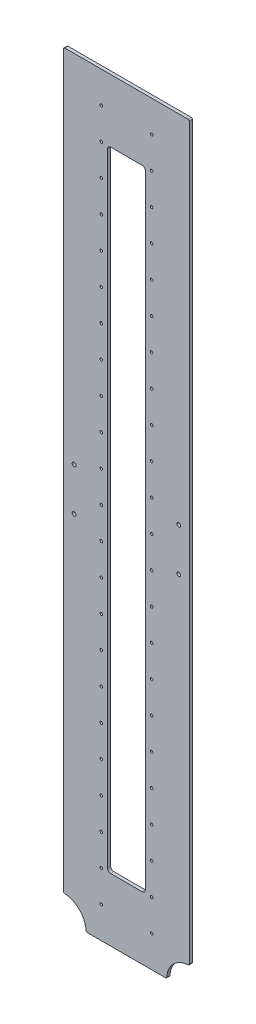
from build123d import *

# Parameters (mm, degrees)
SKETCH1_W           = 200
SKETCH1_H           = 1200
BOSS_EXTRUDE1_DEPTH = 5
CUT_EXTRUDE1_DEPTH  = 609.296802556
SKETCH5_W           = 60
SKETCH5_H           = 1000
CUT_EXTRUDE3_DEPTH  = 609.296802556
FILLET2_R           = 5
SKETCH6_R           = 3
CUT_EXTRUDE4_DEPTH  = 609.296802556
FILLET3_R           = 2
SKETCH9_R           = 2.1
CUT_EXTRUDE5_DEPTH  = 609.296802556


with BuildPart() as part:
    # Sketch1 → Boss-Extrude1 (new body)
    with BuildSketch(Plane.XY):
        Rectangle(SKETCH1_W, SKETCH1_H)
    extrude(amount=BOSS_EXTRUDE1_DEPTH)

    # Sketch3 → Cut-Extrude1 (cut, through all)
    with BuildSketch(Plane.XY.offset(5)):
        with BuildLine():
            Line((-100, -600), (-100, -564.197190267))
            ThreePointArc((-100, -564.197190267), (-74.683590452, -574.683590452), (-64.197190267, -600))
            Line((-64.197190267, -600), (-100, -600))
        make_face()
        with BuildLine():
            Line((64.197190267, -600), (100, -600))
            Line((100, -600), (100, -564.197190267))
            ThreePointArc((100, -564.197190267), (74.683590452, -574.683590452), (64.197190267, -600))
        make_face()
    extrude(amount=-CUT_EXTRUDE1_DEPTH, mode=Mode.SUBTRACT)

    # Sketch5 → Cut-Extrude3 (cut, through all)
    with BuildSketch(Plane.XY.offset(5)):
        Rectangle(SKETCH5_W, SKETCH5_H)
    extrude(amount=-CUT_EXTRUDE3_DEPTH, mode=Mode.SUBTRACT)

    # Fillet2
    fillet2_edges = [part.edges().sort_by_distance(p)[0] for p in [
        (30, 500, 2.5),
        (30, -500, 2.5),
        (-30, -500, 2.5),
        (-30, 500, 2.5),
    ]]
    fillet(fillet2_edges, radius=FILLET2_R)

    # Sketch6 → Cut-Extrude4 (cut, through all)
    with BuildSketch(Plane.XY.offset(5)):
        with Locations((83.193225438, -34)):
            Circle(SKETCH6_R)
        with Locations((83.193225438, 34)):
            Circle(SKETCH6_R)
        with Locations(Location((-83.193225438, 34, 0), (0, 0, 180))):
            Circle(SKETCH6_R)
        with Locations(Location((-83.193225438, -34, 0), (0, 0, 180))):
            Circle(SKETCH6_R)
    extrude(amount=-CUT_EXTRUDE4_DEPTH, mode=Mode.SUBTRACT)

    # Fillet3
    fillet3_edges = [part.edges().sort_by_distance(p)[0] for p in [
        (64.197190267, -600, 2.5),
        (100, -564.197190267, 2.5),
        (-64.197190267, -600, 2.5),
        (-100, -564.197190267, 2.5),
        (-100, 600, 2.5),
        (100, 600, 2.5),
    ]]
    fillet(fillet3_edges, radius=FILLET3_R)

    # Sketch9 → Cut-Extrude5 (cut, through all)
    with BuildSketch(Plane.XY.offset(5)):
        with Locations((-40, 550)):
            Circle(SKETCH9_R)
        with Locations((-40, 500)):
            Circle(SKETCH9_R)
        with Locations((-40, 450)):
            Circle(SKETCH9_R)
        with Locations((-40, 400)):
            Circle(SKETCH9_R)
        with Locations((-40, 350)):
            Circle(SKETCH9_R)
        with Locations((-40, 300)):
            Circle(SKETCH9_R)
        with Locations((-40, 250)):
            Circle(SKETCH9_R)
        with Locations((-40, 200)):
            Circle(SKETCH9_R)
        with Locations((-40, 150)):
            Circle(SKETCH9_R)
        with Locations((-40, 100)):
            Circle(SKETCH9_R)
        with Locations((-40, 50)):
            Circle(SKETCH9_R)
        with Locations((-40, 0)):
            Circle(SKETCH9_R)
        with Locations((-40, -50)):
            Circle(SKETCH9_R)
        with Locations((-40, -100)):
            Circle(SKETCH9_R)
        with Locations((-40, -150)):
            Circle(SKETCH9_R)
        with Locations((-40, -200)):
            Circle(SKETCH9_R)
        with Locations((-40, -250)):
            Circle(SKETCH9_R)
        with Locations((-40, -300)):
            Circle(SKETCH9_R)
        with Locations((-40, -350)):
            Circle(SKETCH9_R)
        with Locations((-40, -400)):
            Circle(SKETCH9_R)
        with Locations((-40, -450)):
            Circle(SKETCH9_R)
        with Locations((-40, -500)):
            Circle(SKETCH9_R)
        with Locations((-40, -550)):
            Circle(SKETCH9_R)
    cut_extrude5 = extrude(amount=-CUT_EXTRUDE5_DEPTH, mode=Mode.SUBTRACT)

    # Mirror1: Cut-Extrude5 across plane
    add(cut_extrude5.mirror(Plane(origin=(0, 0, 0), x_dir=(0, 0, 1), z_dir=(1, 0, 0))), mode=Mode.SUBTRACT)


solid = part.part
